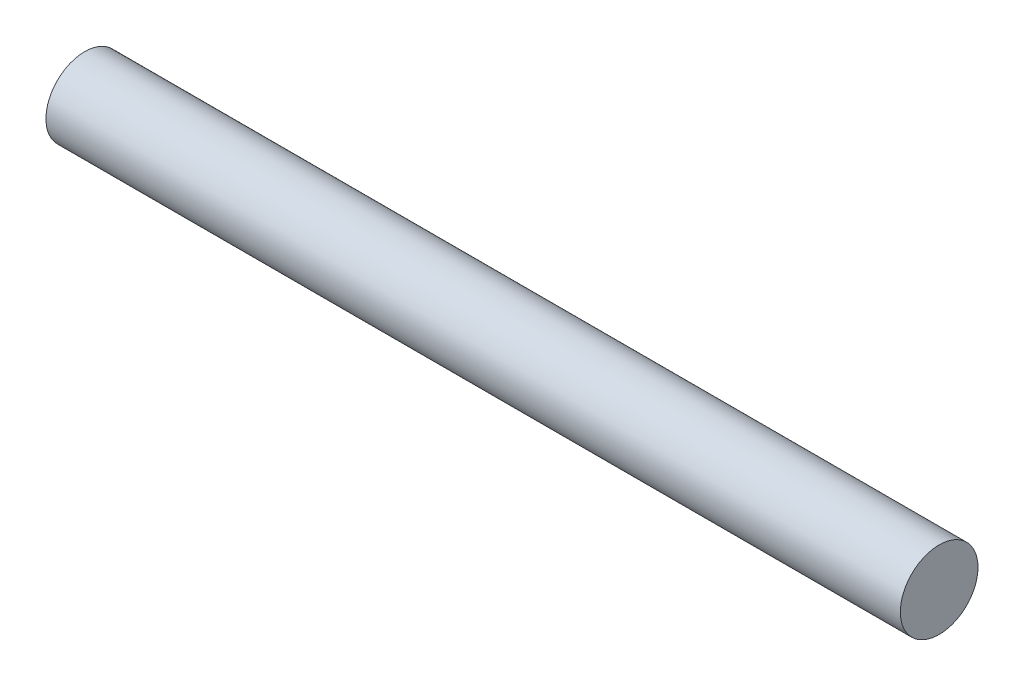
from build123d import *

# Parameters (mm, degrees)
SKETCH1_R           = 3.175
BOSS_EXTRUDE1_DEPTH = 69.85


with BuildPart() as part:
    # Sketch1 → Boss-Extrude1 (new body)
    with BuildSketch(Plane(origin=(0, 0, 0), x_dir=(0, 0, -1), z_dir=(1, 0, 0))):
        Circle(SKETCH1_R)
    extrude(amount=BOSS_EXTRUDE1_DEPTH)


solid = part.part
